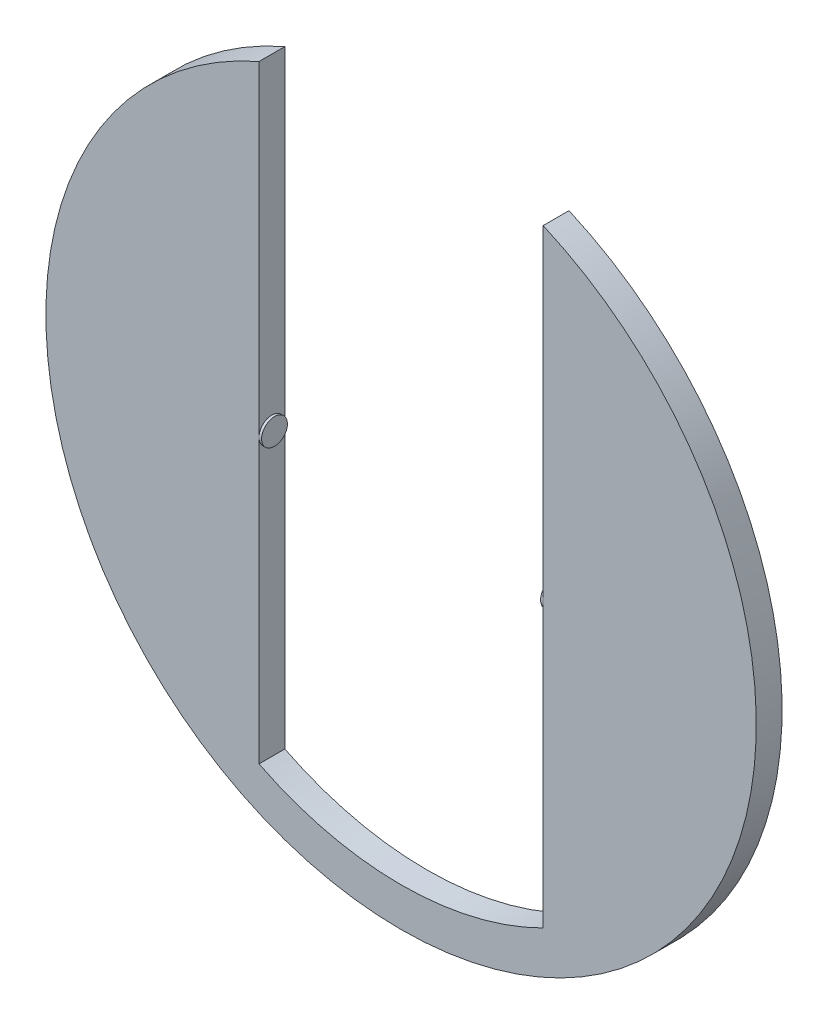
from build123d import *

# Parameters (mm, degrees)
AUFSATZ_LINEAR_AUSTRAGEN1_DEPTH = 20
SKIZZE2_R                       = 10
AUFSATZ_LINEAR_AUSTRAGEN2_DEPTH = 2


with BuildPart() as part:
    # Skizze1 → Aufsatz-Linear austragen1 (new body)
    with BuildSketch(Plane.XY):
        with BuildLine():
            ThreePointArc((-110, 252.041663223), (0, -275), (110, 252.041663223))
            Line((110, 252.041663223), (110, -218.91779279))
            ThreePointArc((110, -218.91779279), (0, -245), (-110, -218.91779279))
            Line((-110, -218.91779279), (-110, 252.041663223))
        make_face()
    extrude(amount=AUFSATZ_LINEAR_AUSTRAGEN1_DEPTH)

    # Skizze2 → Aufsatz-Linear austragen2 (add)
    with BuildSketch(Plane(origin=(-110, 0, 0), x_dir=(0, 0, -1), z_dir=(1, 0, 0))):
        with Locations((-10, 0)):
            Circle(SKIZZE2_R)
    aufsatz_linear_austragen2 = extrude(amount=AUFSATZ_LINEAR_AUSTRAGEN2_DEPTH)

    # Spiegeln1: Aufsatz-Linear austragen2 across plane
    add(aufsatz_linear_austragen2.mirror(Plane(origin=(0, 0, 0), x_dir=(0, 0, 1), z_dir=(1, 0, 0))))


solid = part.part
